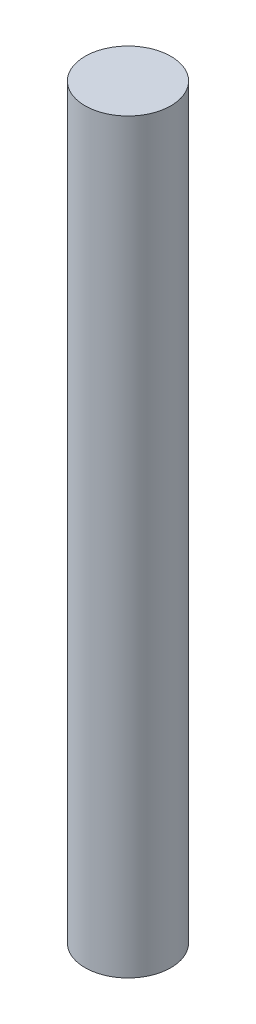
from build123d import *

# Parameters (mm, degrees)
SKETCH1_R           = 5
BOSS_EXTRUDE1_DEPTH = 87


with BuildPart() as part:
    # Sketch1 → Boss-Extrude1 (new body)
    with BuildSketch(Plane(origin=(0, 0, 0), x_dir=(1, 0, 0), z_dir=(0, 1, 0))):
        with Locations(Location((0, 0, 0), (0, 0, 270))):
            Circle(SKETCH1_R)
    extrude(amount=BOSS_EXTRUDE1_DEPTH)


solid = part.part
